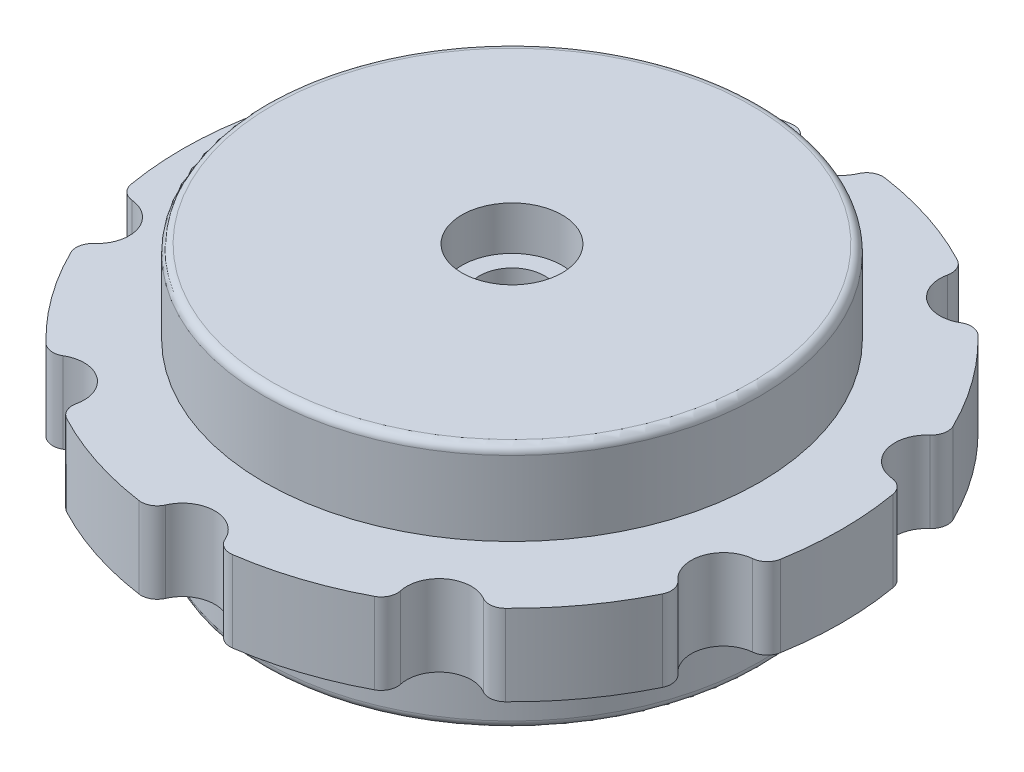
from build123d import *

# Parameters (mm, degrees)
SKETCH_1_R                       = 15.3
SKETCH_1_R_2                     = 13.7
EXTRUDE_1_DEPTH                  = 7.6
SKETCH_1_3_R                     = 20.35
EXTRUDE_2_DEPTH                  = 2.5
SKETCH_1_4_R                     = 2
CUT_EXTRUDE_1_DEPTH              = 30.765836121
FILLET_1_R                       = 1
PATTERN_CIRCULAR_1_COUNT         = 10
FILLET_1_OF_PATTERN_CIRCULAR_1_R = 1
FILLET_2_R                       = 0.5
SKETCH_1_5_R                     = 13.7
EXTRUDE_3_DEPTH                  = 3.9
EXTRUDE_START                    = -7.6
SKETCH_1_6_R                     = 13.7
EXTRUDE_5_DEPTH                  = 15.2
SKETCH_4_R                       = 2
CUT_EXTRUDE_3_DEPTH              = 33.42412133
SKETCH_4_3_R                     = 3.1
CUT_EXTRUDE_4_DEPTH              = 2.7
CUT_EXTRUDE_START                = -12.5
SKETCH_4_4_R                     = 3.1
CUT_EXTRUDE_5_DEPTH              = 2.7
SKETCH_5_R                       = 13
CUT_EXTRUDE_6_DEPTH              = 4.5
SKETCH_6_R                       = 2.75
CUT_EXTRUDE_7_DEPTH              = 2
SKETCH_7_R                       = 0.75
CUT_EXTRUDE_8_DEPTH              = 5


with BuildPart() as part:
    # 草图1 → 凸台-拉伸1 (new, symmetric)
    with BuildSketch(Plane(origin=(0, 0, 0), x_dir=(1, 0, 0), z_dir=(0, 1, 0))):
        with Locations(Location((0, 0, 0), (0, 0, 90))):
            Circle(SKETCH_1_R)
        with Locations(Location((0, 0, 0), (0, 0, 90))):
            Circle(SKETCH_1_R_2, mode=Mode.SUBTRACT)
    extrude(amount=EXTRUDE_1_DEPTH, both=True)

    # 草图1<3> → 凸台-拉伸2 (add, symmetric)
    with BuildSketch(Plane(origin=(0, 0, 0), x_dir=(1, 0, 0), z_dir=(0, 1, 0))):
        with Locations(Location((0, 0, 0), (0, 0, 270))):
            Circle(SKETCH_1_3_R)
    extrude(amount=EXTRUDE_2_DEPTH, both=True)

    # 草图1<4> → 切除-拉伸1 (cut, symmetric)
    with BuildSketch(Plane(origin=(0, 0, 0), x_dir=(1, 0, 0), z_dir=(0, 1, 0))):
        with Locations((0, 20.35)):
            Circle(SKETCH_1_4_R)
    cut_extrude_1 = extrude(amount=CUT_EXTRUDE_1_DEPTH, both=True, mode=Mode.SUBTRACT)

    # 圆角1
    fillet_1_edges = [part.edges().sort_by_distance(p)[0] for p in [
        (-1.997583796, 0, -20.251719902),
        (1.997583796, 0, -20.251719902),
    ]]
    fillet(fillet_1_edges, radius=FILLET_1_R)

    # 阵列(圆周)1: 切除-拉伸1 ×10 about axis
    pattern_circular_1_axis = Axis((0, 0, 0), (0, 1, 0))
    for i in range(1, PATTERN_CIRCULAR_1_COUNT):
        add(cut_extrude_1.rotate(pattern_circular_1_axis, i * 360 / PATTERN_CIRCULAR_1_COUNT), mode=Mode.SUBTRACT)

    # 圆角1 of 阵列(圆周)1
    fillet_1_of_pattern_circular_1_edges = [part.edges().sort_by_distance(p)[0] for p in [
        (-13.51974153, 0, -15.20983527),
        (-10.287583053, 0, -17.558135861),
        (-19.877817519, 0, -4.358310529),
        (-18.643242838, 0, -8.157940701),
        (-18.643242838, 0, 8.157940701),
        (-19.877817519, 0, 4.358310529),
        (-10.287583053, 0, 17.558135861),
        (-13.51974153, 0, 15.20983527),
        (1.997583796, 0, 20.251719902),
        (-1.997583796, 0, 20.251719902),
        (13.51974153, 0, 15.20983527),
        (10.287583053, 0, 17.558135861),
        (19.877817519, 0, 4.358310529),
        (18.643242838, 0, 8.157940701),
        (18.643242838, 0, -8.157940701),
        (19.877817519, 0, -4.358310529),
        (10.287583053, 0, -17.558135861),
        (13.51974153, 0, -15.20983527),
    ]]
    fillet(fillet_1_of_pattern_circular_1_edges, radius=FILLET_1_OF_PATTERN_CIRCULAR_1_R)

    # 圆角2
    fillet_2_edges = [part.edges().sort_by_distance(p)[0] for p in [
        (0, -7.6, 15.3),
        (0, 7.6, 15.3),
    ]]
    fillet(fillet_2_edges, radius=FILLET_2_R)

    # 草图1<5> → 凸台-拉伸3 (add, symmetric)
    with BuildSketch(Plane(origin=(0, 0, 0), x_dir=(1, 0, 0), z_dir=(0, 1, 0))):
        with Locations(Location((0, 0, 0), (0, 0, 90))):
            Circle(SKETCH_1_5_R)
    extrude(amount=EXTRUDE_3_DEPTH, both=True)

    # 草图1<6> → 凸台-拉伸5 (add)
    with BuildSketch(Plane(origin=(0, 0, 0), x_dir=(1, 0, 0), z_dir=(0, 1, 0)).offset(EXTRUDE_START)):
        Circle(SKETCH_1_6_R)
    extrude(amount=EXTRUDE_5_DEPTH)

    # 草图4 → 切除-拉伸3 (cut, through all)
    with BuildSketch(Plane.XZ.offset(7.6)):
        with Locations(Location((0, 0, 0), (0, 0, 270))):
            Circle(SKETCH_4_R)
    extrude(amount=-CUT_EXTRUDE_3_DEPTH, mode=Mode.SUBTRACT)

    # 草图4<3> → 切除-拉伸4 (cut)
    with BuildSketch(Plane.XZ.offset(7.6)):
        with Locations(Location((0, 0, 0), (0, 0, 270))):
            Circle(SKETCH_4_3_R)
    extrude(amount=-CUT_EXTRUDE_4_DEPTH, mode=Mode.SUBTRACT)

    # 草图4<4> → 切除-拉伸5 (cut)
    with BuildSketch(Plane.XZ.offset(7.6).offset(CUT_EXTRUDE_START)):
        with Locations(Location((0, 0, 0), (0, 0, 270))):
            Circle(SKETCH_4_4_R)
    extrude(amount=-CUT_EXTRUDE_5_DEPTH, mode=Mode.SUBTRACT)

    # 草图5 → 切除-拉伸6 (cut)
    with BuildSketch(Plane.XZ.offset(7.6)):
        with Locations(Location((0, 0, 0), (0, 0, 270))):
            Circle(SKETCH_5_R)
    extrude(amount=-CUT_EXTRUDE_6_DEPTH, mode=Mode.SUBTRACT)

    # 草图6 → 切除-拉伸7 (cut)
    with BuildSketch(Plane.XZ.offset(3.1)):
        with Locations(Location((0, 0, 0), (0, 0, 270))):
            Circle(SKETCH_6_R)
    extrude(amount=-CUT_EXTRUDE_7_DEPTH, mode=Mode.SUBTRACT)

    # 草图7 → 切除-拉伸8 (cut)
    with BuildSketch(Plane.XZ.offset(3.1)):
        with Locations(Location((-8, 0, 0), (0, 0, 270))):
            Circle(SKETCH_7_R)
        with Locations(Location((4, 6.92820323, 0), (0, 0, 270))):
            Circle(SKETCH_7_R)
        with Locations(Location((4, -6.92820323, 0), (0, 0, 270))):
            Circle(SKETCH_7_R)
    extrude(amount=-CUT_EXTRUDE_8_DEPTH, mode=Mode.SUBTRACT)


solid = part.part
